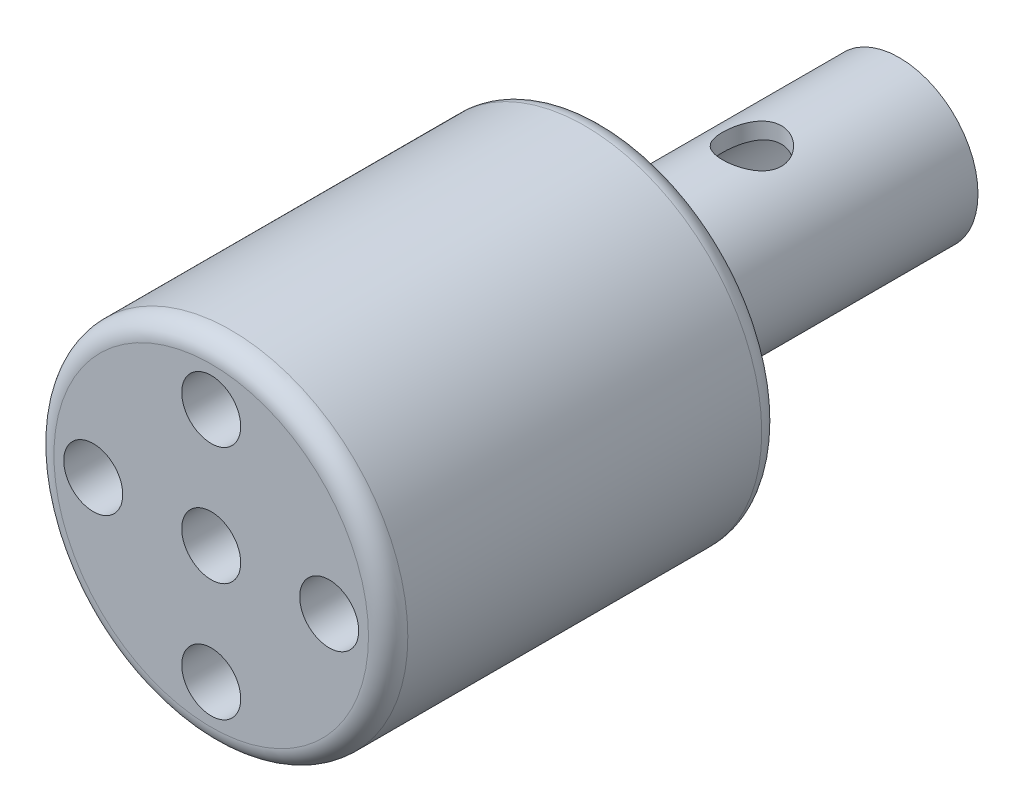
from build123d import *

# Parameters (mm, degrees)
ESQUISSE1_R                  = 9
ESQUISSE1_R_2                = 1.5
BOSS_EXTRU_1_DEPTH           = 20
ESQUISSE2_R                  = 4
ESQUISSE2_R_2                = 3.19
BOSS_EXTRU_2_DEPTH           = 15
CONG_1_R                     = 0.25
CONG_2_R                     = 1
CONG_3_R                     = 1
ENL_V_MAT_EXTRU_1_DEPTH      = 10
ENL_V_MAT_EXTRU_1_DEPTH_BACK = 10
ESQUISSE3_R                  = 1.5
ESQUISSE4_R                  = 1.5
ENL_V_MAT_EXTRU_2_DEPTH      = 10


with BuildPart() as part:
    # Esquisse1 → Boss.-Extru.1 (new body)
    with BuildSketch(Plane.XY):
        Circle(ESQUISSE1_R)
        with Locations((0, 6)):
            Circle(ESQUISSE1_R_2, mode=Mode.SUBTRACT)
        with Locations((6, 0)):
            Circle(ESQUISSE1_R_2, mode=Mode.SUBTRACT)
        with Locations((0, -6)):
            Circle(ESQUISSE1_R_2, mode=Mode.SUBTRACT)
        with Locations((-6, 0)):
            Circle(ESQUISSE1_R_2, mode=Mode.SUBTRACT)
    extrude(amount=BOSS_EXTRU_1_DEPTH)

    # Esquisse2 → Boss.-Extru.2 (add)
    with BuildSketch(Plane(origin=(0, 0, 0), x_dir=(-1, 0, 0), z_dir=(0, 0, -1))):
        Circle(ESQUISSE2_R)
        Circle(ESQUISSE2_R_2, mode=Mode.SUBTRACT)
    extrude(amount=BOSS_EXTRU_2_DEPTH)

    # Congé1
    cong_1_edges = [part.edges().sort_by_distance(p)[0] for p in [
        (4, 0, 0),
    ]]
    fillet(cong_1_edges, radius=CONG_1_R)

    # Congé2
    cong_2_edges = [part.edges().sort_by_distance(p)[0] for p in [
        (-9, 0, 20),
    ]]
    fillet(cong_2_edges, radius=CONG_2_R)

    # Congé3
    cong_3_edges = [part.edges().sort_by_distance(p)[0] for p in [
        (-9, 0, 0),
    ]]
    fillet(cong_3_edges, radius=CONG_3_R)

    # Esquisse3 → Enlèv. mat.-Extru.1 (cut, two sides: drawn at the far end of the back side and taken through both)
    with BuildSketch(Plane(origin=(0, 0, 0), x_dir=(1, 0, 0), z_dir=(0, 1, 0)).offset(-ENL_V_MAT_EXTRU_1_DEPTH_BACK)):
        with Locations((0, 7.5)):
            Circle(ESQUISSE3_R)
    extrude(amount=ENL_V_MAT_EXTRU_1_DEPTH + ENL_V_MAT_EXTRU_1_DEPTH_BACK, mode=Mode.SUBTRACT)

    # Esquisse4 → Enlèv. mat.-Extru.2 (cut)
    with BuildSketch(Plane.XY.offset(20)):
        Circle(ESQUISSE4_R)
    extrude(amount=-ENL_V_MAT_EXTRU_2_DEPTH, mode=Mode.SUBTRACT)


solid = part.part
